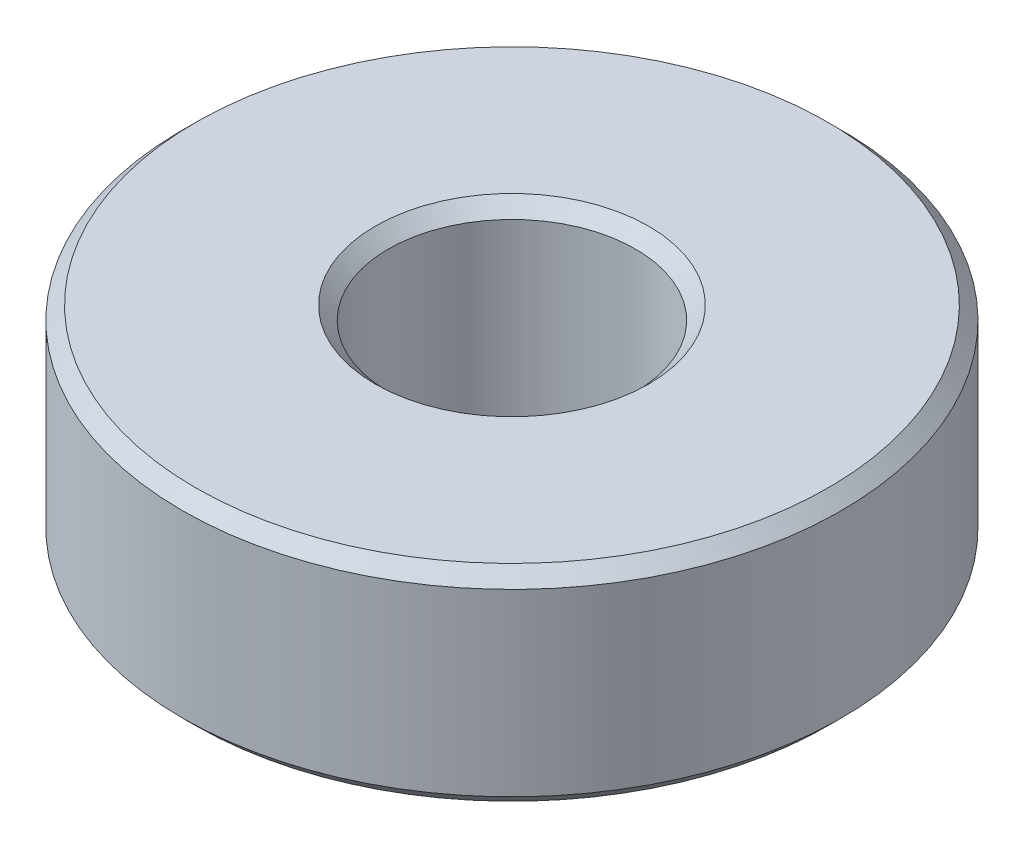
from build123d import *

# Parameters (mm, degrees)
SKETCH1_R                      = 6.35
BOSS_EXTRUDE1_DEPTH            = 3.96875
F_3_16_0_1875_DIAMETER_HOLE1_D = 4.7625
CHAMFER1_SIZE                  = 0.254


with BuildPart() as part:
    # Sketch1 → Boss-Extrude1 (new body)
    with BuildSketch(Plane(origin=(0, 0, 0), x_dir=(1, 0, 0), z_dir=(0, 1, 0))):
        with Locations(Location((0, 0, 0), (0, 0, 270))):
            Circle(SKETCH1_R)
    extrude(amount=BOSS_EXTRUDE1_DEPTH)

    # 3/16 (0.1875) Diameter Hole1 (through all)
    with Locations(Plane(origin=(0, 3.96875, 0), x_dir=(1, 0, 0), z_dir=(0, 1, 0))):
        with Locations((0, 0)):
            Hole(F_3_16_0_1875_DIAMETER_HOLE1_D / 2)

    # Chamfer1
    chamfer1_edges = [part.edges().sort_by_distance(p)[0] for p in [
        (0, 0, -6.35),
        (0, 3.96875, -6.35),
        (2.38125, 3.96875, 0),
        (2.38125, 0, 0),
    ]]
    chamfer(chamfer1_edges, length=CHAMFER1_SIZE)


solid = part.part
